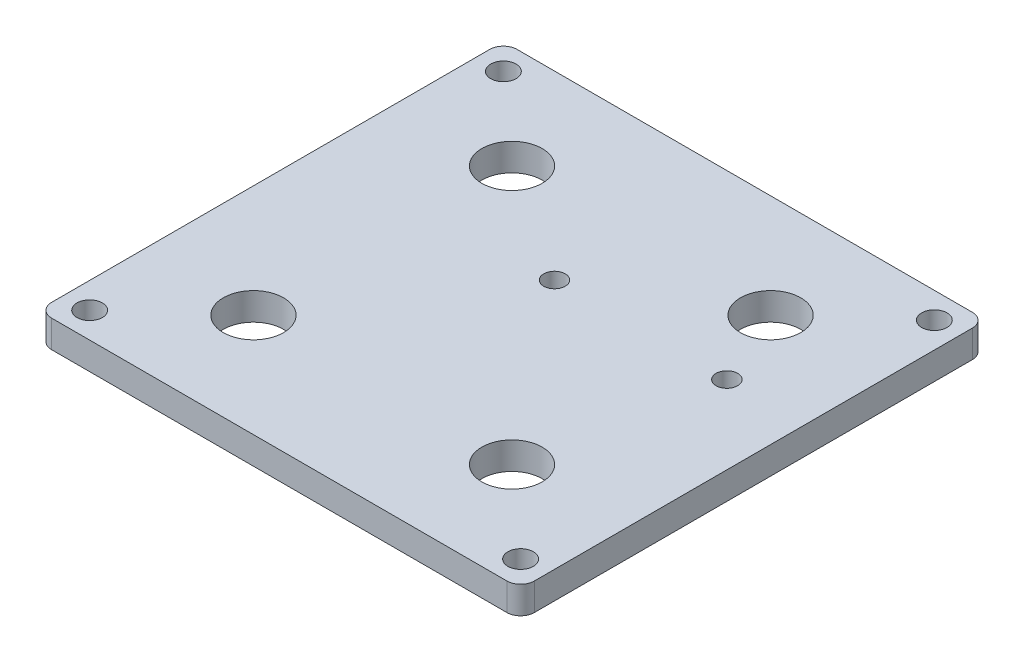
from build123d import *

# Parameters (mm, degrees)
SKETCH1_W             = 44
SKETCH1_H             = 44
SKETCH1_R             = 0.5
SKETCH1_R_2           = 3.5
SKETCH1_H_2           = 5
BOSS_EXTRUDE1_DEPTH   = 3.175
SKETCH3_W             = 6
SKETCH3_H             = 54
SKETCH3_R             = 1.4732
BOSS_EXTRUDE2_DEPTH   = 3.175
M3X0_5_TAPPED_HOLE1_D = 2.5
FILLET1_R             = 1.5875


with BuildPart() as part:
    # Sketch1 → Boss-Extrude1 (new body)
    # profile 1 of 3: a face of its own
    with BuildSketch(Plane(origin=(0, 0, 0), x_dir=(1, 0, 0), z_dir=(0, 1, 0))):
        with Locations((22, -22)):
            Rectangle(SKETCH1_W, SKETCH1_H)
        with Locations(Location((40.93, -16, 0), (0, 0, 270))):
            Circle(SKETCH1_R, mode=Mode.SUBTRACT)
        with Locations(Location((20.93, -16, 0), (0, 0, 270))):
            Circle(SKETCH1_R, mode=Mode.SUBTRACT)
        with Locations(Location((7, -37, 0), (0, 0, 270))):
            Circle(SKETCH1_R_2, mode=Mode.SUBTRACT)
        with Locations(Location((37, -37, 0), (0, 0, 270))):
            Circle(SKETCH1_R_2, mode=Mode.SUBTRACT)
        with Locations(Location((37, -7, 0), (0, 0, 270))):
            Circle(SKETCH1_R_2, mode=Mode.SUBTRACT)
        with Locations(Location((7, -7, 0), (0, 0, 270))):
            Circle(SKETCH1_R_2, mode=Mode.SUBTRACT)
    # profile 2 of 3: a face of its own
    with BuildSketch(Plane(origin=(0, 0, 0), x_dir=(1, 0, 0), z_dir=(0, 1, 0))):
        with Locations((22, 2.5)):
            Rectangle(SKETCH1_W, SKETCH1_H_2)
    # profile 3 of 3: a face of its own
    with BuildSketch(Plane(origin=(0, 0, 0), x_dir=(1, 0, 0), z_dir=(0, 1, 0))):
        with Locations((22, -46.5)):
            Rectangle(SKETCH1_W, SKETCH1_H_2)
    extrude(amount=BOSS_EXTRUDE1_DEPTH)

    # Sketch3 → Boss-Extrude2 (add)
    # profile 1 of 2: a face of its own
    with BuildSketch(Plane(origin=(0, 3.175, 0), x_dir=(1, 0, 0), z_dir=(0, 1, 0))):
        with Locations((-3, -22)):
            Rectangle(SKETCH3_W, SKETCH3_H)
        with Locations(Location((-3, 2, 0), (0, 0, 270))):
            Circle(SKETCH3_R, mode=Mode.SUBTRACT)
        with Locations(Location((-3, -46, 0), (0, 0, 270))):
            Circle(SKETCH3_R, mode=Mode.SUBTRACT)
    # profile 2 of 2: a face of its own
    with BuildSketch(Plane(origin=(0, 3.175, 0), x_dir=(1, 0, 0), z_dir=(0, 1, 0))):
        with Locations((47, -22)):
            Rectangle(SKETCH3_W, SKETCH3_H)
        with Locations(Location((47, -46, 0), (0, 0, 270))):
            Circle(SKETCH3_R, mode=Mode.SUBTRACT)
        with Locations(Location((47, 2, 0), (0, 0, 270))):
            Circle(SKETCH3_R, mode=Mode.SUBTRACT)
    extrude(amount=-BOSS_EXTRUDE2_DEPTH)

    # M3x0.5 Tapped Hole1 (through all)
    with Locations(Plane(origin=(40.93, 3.175, 16), x_dir=(0, 0, 1), z_dir=(0, 1, 0))):
        with Locations((0, 0), (0, -20)):
            Hole(M3X0_5_TAPPED_HOLE1_D / 2)

    # Fillet1
    fillet1_edges = [part.edges().sort_by_distance(p)[0] for p in [
        (-6, 1.5875, -5),
        (-6, 1.5875, 49),
        (50, 1.5875, 49),
        (50, 1.5875, -5),
    ]]
    fillet(fillet1_edges, radius=FILLET1_R)


solid = part.part
